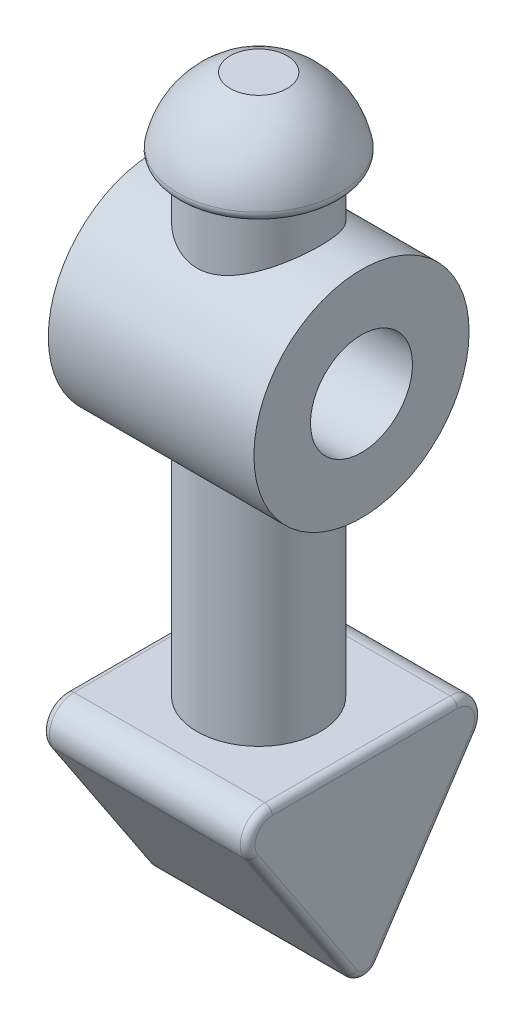
from build123d import *

# Parameters (mm, degrees)
SKETCH1_R                = 16.6116
BOSS_EXTRUDE1_DEPTH      = 31.75
SKETCH5_R                = 7.874
CUT_EXTRUDE4_DEPTH       = 31.75
SKETCH7_R                = 9.525
BOSS_EXTRUDE2_DEPTH      = 14.732
SKETCH8_R                = 12.7
BOSS_EXTRUDE3_DEPTH      = 11.43
FILLET5_R                = 1.27
BOSS_EXTRUDE4_DEPTH      = 15.875
BOSS_EXTRUDE4_DEPTH_BACK = 15.875
BOSS_EXTRUDE5_DEPTH      = 31.75
BOSS_EXTRUDE5_DEPTH_BACK = 3.81
SKETCH13_R               = 9.525
FILLET6_R                = 1.143


with BuildPart() as part:
    # Sketch1 → Boss-Extrude1 (new body)
    with BuildSketch(Plane(origin=(0, 0, 0), x_dir=(0, 0, -1), z_dir=(1, 0, 0))):
        Circle(SKETCH1_R)
    extrude(amount=BOSS_EXTRUDE1_DEPTH)

    # Sketch5 → Cut-Extrude4 (cut)
    with BuildSketch(Plane.ZY):
        Circle(SKETCH5_R)
    extrude(amount=-CUT_EXTRUDE4_DEPTH, mode=Mode.SUBTRACT)

    # Sketch7 → Boss-Extrude2 (add)
    with BuildSketch(Plane(origin=(0, 23.63216, 0), x_dir=(1, 0, 0), z_dir=(0, 1, 0))):
        with Locations(Location((15.875, 0, 0), (0, 0, 270))):
            Circle(SKETCH7_R)
    extrude(amount=-BOSS_EXTRUDE2_DEPTH)

    # Sketch8 → Boss-Extrude3 (add)
    with BuildSketch(Plane(origin=(0, 23.63216, 0), x_dir=(1, 0, 0), z_dir=(0, 1, 0))):
        with Locations(Location((15.875, 0, 0), (0, 0, 270))):
            Circle(SKETCH8_R)
    extrude(amount=BOSS_EXTRUDE3_DEPTH)

    # Sketch10 → Cut-Revolve1 (revolve, cut)
    with BuildSketch(Plane.XY, mode=Mode.PRIVATE) as cut_revolve1_sk:
        with BuildLine():
            Line((11.487410409, 35.062159614), (3.175, 35.06216))
            Line((3.175, 35.06216), (3.175, 23.63216))
            ThreePointArc((3.175, 23.63216), (5.734420744, 30.508413369), (11.487410409, 35.062159614))
        make_face()
    revolve(cut_revolve1_sk.sketch.rotate(Axis((15.875, 35.06216, 0), (0, -1, 0)), 270), axis=Axis((15.875, 35.06216, 0), (0, -1, 0)), mode=Mode.SUBTRACT)

    # Fillet5
    fillet5_edges = [part.edges().sort_by_distance(p)[0] for p in [
        (15.875, 23.63216, -12.7),
    ]]
    fillet(fillet5_edges, radius=FILLET5_R)



with BuildPart() as body_2:
    # Sketch12 → Boss-Extrude4 (new, two sides: drawn at the far end of the back side and taken through both)
    with BuildSketch(Plane(origin=(15.875, 0, 0), x_dir=(0, 0, -1), z_dir=(1, 0, 0)).offset(-BOSS_EXTRUDE4_DEPTH_BACK)):
        with BuildLine():
            Line((2.629138572, -77.398426312), (7.313053442, -70.340553032))
            Line((7.313053442, -70.340553032), (17.972630658, -54.27835991))
            ThreePointArc((17.972630658, -54.27835991), (18.155391887, -50.370302586), (14.798097199, -48.3616))
            Line((14.798097199, -48.3616), (-13.770933928, -48.3616))
            ThreePointArc((-13.770933928, -48.3616), (-17.128181434, -50.370214649), (-16.945577748, -54.278193604))
            Line((-16.945577748, -54.278193604), (-6.287102166, -70.340553032))
            Line((-6.287102166, -70.340553032), (-1.603719855, -77.398426312))
            ThreePointArc((-1.603719855, -77.398426312), (0.512709359, -78.534030576), (2.629138572, -77.398426312))
        make_face()
    extrude(amount=BOSS_EXTRUDE4_DEPTH + BOSS_EXTRUDE4_DEPTH_BACK)


with BuildPart() as part_1:
    add(part.part)

    add(body_2.part)  # Boss-Extrude5 merges body 2
    # Sketch13 → Boss-Extrude5 (add, two sides: drawn at the far end of the back side and taken through both)
    with BuildSketch(Plane(origin=(0, -16.6116, 0), x_dir=(-1, 0, 0), z_dir=(0, -1, 0)).offset(-BOSS_EXTRUDE5_DEPTH_BACK)):
        with Locations(Location((-15.875, 0, 0), (0, 0, 270))):
            Circle(SKETCH13_R)
    extrude(amount=BOSS_EXTRUDE5_DEPTH + BOSS_EXTRUDE5_DEPTH_BACK)

    # Fillet6
    fillet6_edges = [part_1.edges().sort_by_distance(p)[0] for p in [
        (0, -50.370214649, 17.128181434),
        (0, -48.3616, -0.513581636),
        (0, -50.370302586, -18.155391887),
        (0, -65.838393111, -10.300884615),
        (0, -78.534030576, -0.512709359),
        (0, -65.838309958, 9.274648801),
        (31.75, -50.370214649, 17.128181434),
        (31.75, -65.838309958, 9.274648801),
        (31.75, -78.534030576, -0.512709359),
        (31.75, -65.838393111, -10.300884615),
        (31.75, -50.370302586, -18.155391887),
        (31.75, -48.3616, -0.513581636),
    ]]
    fillet(fillet6_edges, radius=FILLET6_R)


solid = part_1.part
